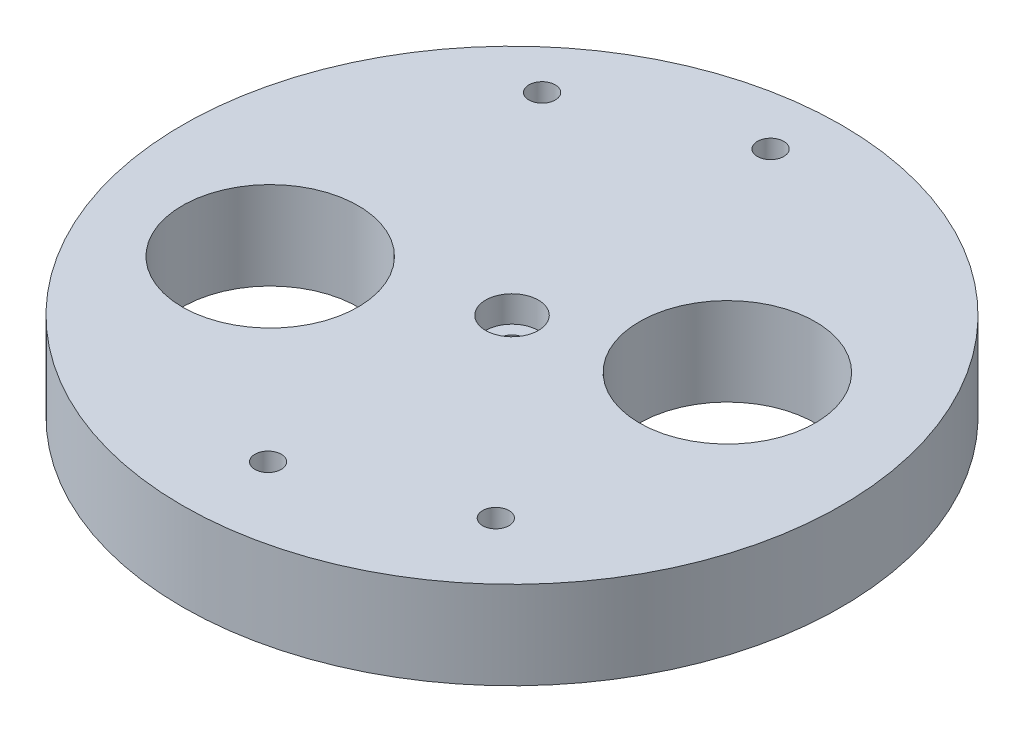
from build123d import *

# Parameters (mm, degrees)
SKETCH1_R           = 37.5
BOSS_EXTRUDE1_DEPTH = 10
SKETCH3_R           = 1.5
CUT_EXTRUDE3_DEPTH  = 54.967582862
SKETCH4_R           = 5
CUT_EXTRUDE4_DEPTH  = 5
SKETCH5_R           = 1.5
CUT_EXTRUDE5_DEPTH  = 54.967582862
SKETCH6_R           = 3
CUT_EXTRUDE6_DEPTH  = 5
SKETCH8_R           = 3
CUT_EXTRUDE7_DEPTH  = 3
SKETCH9_R           = 10
CUT_EXTRUDE8_DEPTH  = 54.967582862


with BuildPart() as part:
    # Sketch1 → Boss-Extrude1 (new body)
    with BuildSketch(Plane(origin=(0, 0, 0), x_dir=(1, 0, 0), z_dir=(0, 1, 0))):
        with Locations(Location((0, 0, 0), (0, 0, 270))):
            Circle(SKETCH1_R)
    extrude(amount=BOSS_EXTRUDE1_DEPTH)

    # Sketch3 → Cut-Extrude3 (cut, through all)
    with BuildSketch(Plane(origin=(0, 10, 0), x_dir=(1, 0, 0), z_dir=(0, 1, 0))):
        with Locations(Location((0, 0, 0), (0, 0, 270))):
            Circle(SKETCH3_R)
    extrude(amount=-CUT_EXTRUDE3_DEPTH, mode=Mode.SUBTRACT)

    # Sketch4 → Cut-Extrude4 (cut)
    with BuildSketch(Plane.XZ):
        with Locations(Location((0, 0, 0), (0, 0, 270))):
            Circle(SKETCH4_R)
    extrude(amount=-CUT_EXTRUDE4_DEPTH, mode=Mode.SUBTRACT)

    # Sketch5 → Cut-Extrude5 (cut, through all)
    with BuildSketch(Plane(origin=(0, 10, 0), x_dir=(1, 0, 0), z_dir=(0, 1, 0))):
        with BuildLine():
            ThreePointArc((-18.854509148, 24.228237343), (-21.625950603, 24.261294568), (-19.689620544, 22.278214534))
            Line((-19.689620544, 22.278214534), (-20.247076251, 23.670781637))
            Line((-20.247076251, 23.670781637), (-18.854509148, 24.228237343))
        make_face()
        with BuildLine():
            Line((-20.247076251, 23.670781637), (-19.689620544, 22.278214534))
            ThreePointArc((-19.689620544, 22.278214534), (-19.004863797, 22.830003295), (-18.747076251, 23.670781637))
            ThreePointArc((-18.747076251, 23.670781637), (-18.774179334, 23.954638419), (-18.854509148, 24.228237343))
            Line((-18.854509148, 24.228237343), (-20.247076251, 23.670781637))
        make_face()
        with BuildLine():
            ThreePointArc((-3.072081987, 30.546068688), (-2.270027815, 29.724650042), (-1.122059178, 29.710957292))
            Line((-1.122059178, 29.710957292), (-1.679514884, 31.103524394))
            Line((-1.679514884, 31.103524394), (-3.072081987, 30.546068688))
        make_face()
        with BuildLine():
            Line((-1.679514884, 31.103524394), (-1.122059178, 29.710957292))
            ThreePointArc((-1.122059178, 29.710957292), (-0.437302431, 30.262746053), (-0.179514884, 31.103524394))
            ThreePointArc((-0.179514884, 31.103524394), (-1.963371667, 32.576421311), (-3.072081987, 30.546068688))
            Line((-3.072081987, 30.546068688), (-1.679514884, 31.103524394))
        make_face()
        with Locations(Location((19.070534713, -20.910318461, 0), (0, 0, 270))):
            Circle(SKETCH5_R)
        with Locations(Location((0.564603471, -28.318390189, 0), (0, 0, 270))):
            Circle(SKETCH5_R)
    extrude(amount=-CUT_EXTRUDE5_DEPTH, mode=Mode.SUBTRACT)

    # Sketch6 → Cut-Extrude6 (cut)
    with BuildSketch(Plane.XZ):
        with Locations(Location((19.070534713, 20.910318461, 0), (0, 0, 270))):
            Circle(SKETCH6_R)
        with Locations(Location((0.564603471, 28.318390189, 0), (0, 0, 270))):
            Circle(SKETCH6_R)
        with Locations(Location((-1.679514884, -31.103524394, 0), (0, 0, 270))):
            Circle(SKETCH6_R)
        with Locations(Location((-20.247076251, -23.670781637, 0), (0, 0, 270))):
            Circle(SKETCH6_R)
    extrude(amount=-CUT_EXTRUDE6_DEPTH, mode=Mode.SUBTRACT)

    # Sketch8 → Cut-Extrude7 (cut)
    with BuildSketch(Plane(origin=(0, 10, 0), x_dir=(1, 0, 0), z_dir=(0, 1, 0))):
        with Locations(Location((0, 0, 0), (0, 0, 270))):
            Circle(SKETCH8_R)
    extrude(amount=-CUT_EXTRUDE7_DEPTH, mode=Mode.SUBTRACT)

    # Sketch9 → Cut-Extrude8 (cut, through all)
    with BuildSketch(Plane(origin=(0, 10, 0), x_dir=(1, 0, 0), z_dir=(0, 1, 0))):
        with Locations(Location((17.876448336, 6.629278922, 0), (0, 0, 270))):
            Circle(SKETCH9_R)
        with Locations(Location((-19.565700474, -7.94754173, 0), (0, 0, 270))):
            Circle(SKETCH9_R)
    extrude(amount=-CUT_EXTRUDE8_DEPTH, mode=Mode.SUBTRACT)


solid = part.part
